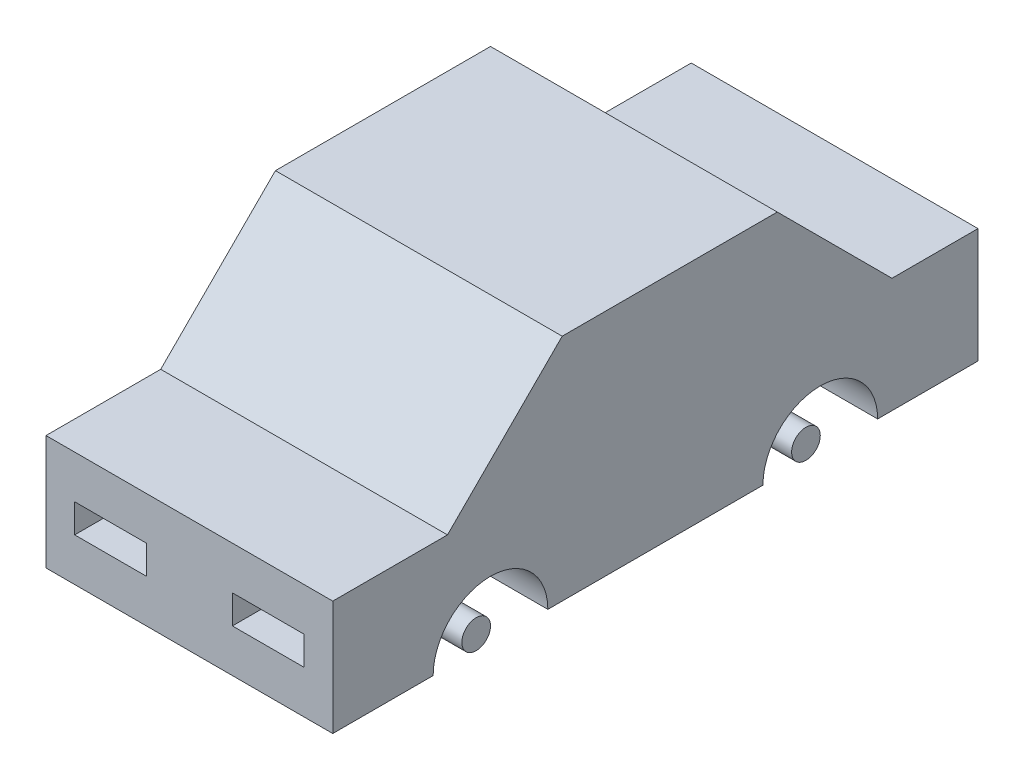
from build123d import *

# Parameters (mm, degrees)
BOSS_EXTRUDE1_DEPTH = 1000
CUT_EXTRUDE3_DEPTH  = 400
CUT_EXTRUDE4_START  = -400
CUT_EXTRUDE4_DEPTH  = 400
SKETCH7_R           = 100
BOSS_EXTRUDE2_DEPTH = 900
SKETCH8_W           = 500
SKETCH8_H           = 200
CUT_EXTRUDE5_DEPTH  = 300


with BuildPart() as part:
    # Car_Profile → Boss-Extrude1 (new, symmetric)
    with BuildSketch(Plane(origin=(0, 0, 0), x_dir=(0, 0, -1), z_dir=(1, 0, 0))):
        Polygon((2250, 0), (2250, 800), (1650, 800), (850, 1600), (-650, 1600), (-1450, 800), (-2250, 800), (-2250, 0), align=None)
    extrude(amount=BOSS_EXTRUDE1_DEPTH, both=True)

    # Sketch4 → Cut-Extrude3 (cut)
    with BuildSketch(Plane(origin=(1000, 0, 0), x_dir=(0, 0, -1), z_dir=(1, 0, 0))):
        with BuildLine():
            Line((-750, 0), (-1550, 0))
            ThreePointArc((-1550, 0), (-1150, 400), (-750, 0))
        make_face()
        with BuildLine():
            Line((750, 0), (1550, 0))
            ThreePointArc((1550, 0), (1150, 400), (750, 0))
        make_face()
    extrude(amount=-CUT_EXTRUDE3_DEPTH, mode=Mode.SUBTRACT)

    # Sketch6 → Cut-Extrude4 (cut)
    with BuildSketch(Plane.ZY.offset(1000).offset(CUT_EXTRUDE4_START)):
        with BuildLine():
            Line((-750, 0), (-1550, 0))
            ThreePointArc((-1550, 0), (-1150, 400), (-750, 0))
        make_face()
        with BuildLine():
            Line((750, 0), (1550, 0))
            ThreePointArc((1550, 0), (1150, 400), (750, 0))
        make_face()
    extrude(amount=CUT_EXTRUDE4_DEPTH, mode=Mode.SUBTRACT)

    # Sketch7 → Boss-Extrude2 (add, symmetric)
    with BuildSketch(Plane(origin=(0, 0, 0), x_dir=(0, 0, -1), z_dir=(1, 0, 0))):
        with Locations((-1150, 0)):
            Circle(SKETCH7_R)
        with Locations((1150, 0)):
            Circle(SKETCH7_R)
    extrude(amount=BOSS_EXTRUDE2_DEPTH, both=True)

    # Sketch8 → Cut-Extrude5 (cut)
    with BuildSketch(Plane.XY.offset(2250)):
        with Locations((-550, 400)):
            Rectangle(SKETCH8_W, SKETCH8_H)
        with Locations((550, 400)):
            Rectangle(SKETCH8_W, SKETCH8_H)
    extrude(amount=-CUT_EXTRUDE5_DEPTH, mode=Mode.SUBTRACT)


solid = part.part
